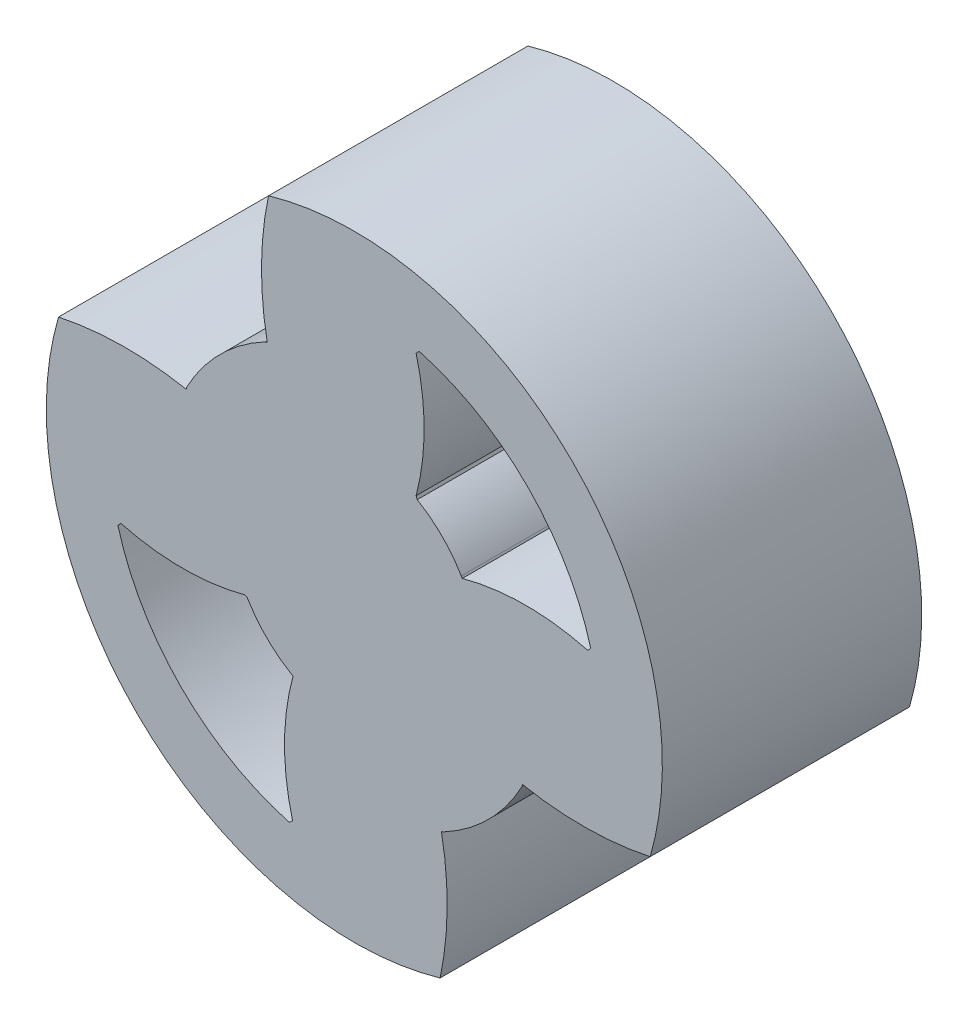
from build123d import *

# Parameters (mm, degrees)
BOSS_EXTRUDE1_DEPTH = 10.181166667
SKETCH2_R           = 5
CUT_EXTRUDE1_DEPTH  = 1
CUT_EXTRUDE2_DEPTH  = 7.5


with BuildPart() as part:
    # Sketch1 → Boss-Extrude1 (new body)
    with BuildSketch(Plane.XY):
        with BuildLine():
            Line((-6.59848134, 3.41844841), (-6.587531167, 3.487972592))
            ThreePointArc((-6.587531167, 3.487972592), (-5.270745663, 5.270745663), (-3.487972592, 6.587531167))
            Line((-3.487972592, 6.587531167), (-3.41844841, 6.59848134))
            ThreePointArc((-3.41844841, 6.59848134), (-3.64449132, 9.108619705), (-3.367456173, 11.613642965))
            ThreePointArc((-3.367456173, 11.613642965), (8.550335198, 8.550335198), (11.613642965, -3.367456173))
            ThreePointArc((11.613642965, -3.367456173), (9.108619705, -3.64449132), (6.59848134, -3.41844841))
            Line((6.59848134, -3.41844841), (6.587531167, -3.487972592))
            ThreePointArc((6.587531167, -3.487972592), (5.270745663, -5.270745663), (3.487972592, -6.587531167))
            Line((3.487972592, -6.587531167), (3.41844841, -6.59848134))
            ThreePointArc((3.41844841, -6.59848134), (3.64449132, -9.108619705), (3.367456173, -11.613642965))
            ThreePointArc((3.367456173, -11.613642965), (-8.550335198, -8.550335198), (-11.613642965, 3.367456173))
            ThreePointArc((-11.613642965, 3.367456173), (-9.108619705, 3.64449132), (-6.59848134, 3.41844841))
        make_face()
    extrude(amount=BOSS_EXTRUDE1_DEPTH)

    # Sketch2 → Cut-Extrude1 (cut)
    with BuildSketch(Plane(origin=(0, 0, 0), x_dir=(-1, 0, 0), z_dir=(0, 0, -1))):
        Circle(SKETCH2_R)
    extrude(amount=-CUT_EXTRUDE1_DEPTH, mode=Mode.SUBTRACT)

    # Sketch3 → Cut-Extrude2 (cut)
    with BuildSketch(Plane.XY.offset(10.181166667)):
        with BuildLine():
            Line((9.15948917, 2.425242905), (9.281504474, 2.548391591))
            ThreePointArc((9.281504474, 2.548391591), (6.805902769, 6.805902769), (2.548391591, 9.281504474))
            Line((2.548391591, 9.281504474), (2.425242905, 9.15948917))
            ThreePointArc((2.425242905, 9.15948917), (2.740607895, 6.73570708), (2.425506361, 4.311890725))
            Line((2.425506361, 4.311890725), (2.4714668, 4.200130912))
            ThreePointArc((2.4714668, 4.200130912), (3.445957619, 3.445957619), (4.200130912, 2.4714668))
            Line((4.200130912, 2.4714668), (4.238745161, 2.405843866))
            ThreePointArc((4.238745161, 2.405843866), (6.481209779, 2.737203521), (8.738209013, 2.5264875))
            ThreePointArc((8.738209013, 2.5264875), (8.949427835, 2.478273365), (9.15948917, 2.425242905))
        make_face()
    cut_extrude2 = extrude(amount=-CUT_EXTRUDE2_DEPTH, mode=Mode.SUBTRACT)

    # Mirror1: Cut-Extrude2 across plane
    add(cut_extrude2.mirror(Plane(origin=(0, 0, 0), x_dir=(0, 0, 1), z_dir=(0.7071067811865475, 0.7071067811865477, 0))), mode=Mode.SUBTRACT)


solid = part.part
